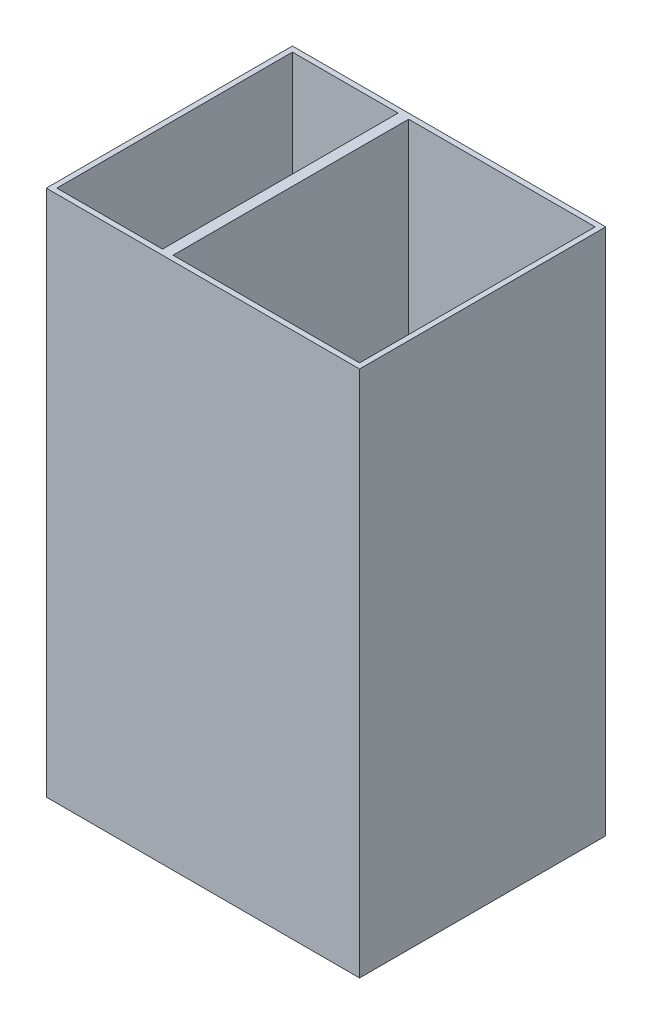
from build123d import *

# Parameters (mm, degrees)
ESBO_O1_W                = 89.1
ESBO_O1_H                = 70
ESBO_O1_W_2              = 53.05
ESBO_O1_H_2              = 67
ESBO_O1_W_3              = 30.05
RESSALTO_EXTRUS_O1_DEPTH = 150
ESBO_O3_R                = 2
ESBO_O3_R_2              = 4.525
CORTE_EXTRUS_O1_DEPTH    = 3


with BuildPart() as part:
    # Esboço1 → Ressalto-extrusão1 (new body)
    with BuildSketch(Plane(origin=(0, 0, 0), x_dir=(1, 0, 0), z_dir=(0, 1, 0))):
        Rectangle(ESBO_O1_W, ESBO_O1_H)
        with Locations((16.525, 0)):
            Rectangle(ESBO_O1_W_2, ESBO_O1_H_2, mode=Mode.SUBTRACT)
        with Locations((-28.025, 0)):
            Rectangle(ESBO_O1_W_3, ESBO_O1_H_2, mode=Mode.SUBTRACT)
    extrude(amount=RESSALTO_EXTRUS_O1_DEPTH)

    # Esboço3 → Corte-extrusão1 (cut)
    with BuildSketch(Plane(origin=(-10, 0, 0), x_dir=(0, 0, -1), z_dir=(1, 0, 0))):
        with Locations((17.5, 75.034551114)):
            Circle(ESBO_O3_R)
        with Locations((-17.5, 75.034551114)):
            Circle(ESBO_O3_R)
        with Locations((0, 83.034551114)):
            Circle(ESBO_O3_R_2)
    extrude(amount=-CORTE_EXTRUS_O1_DEPTH, mode=Mode.SUBTRACT)


solid = part.part
